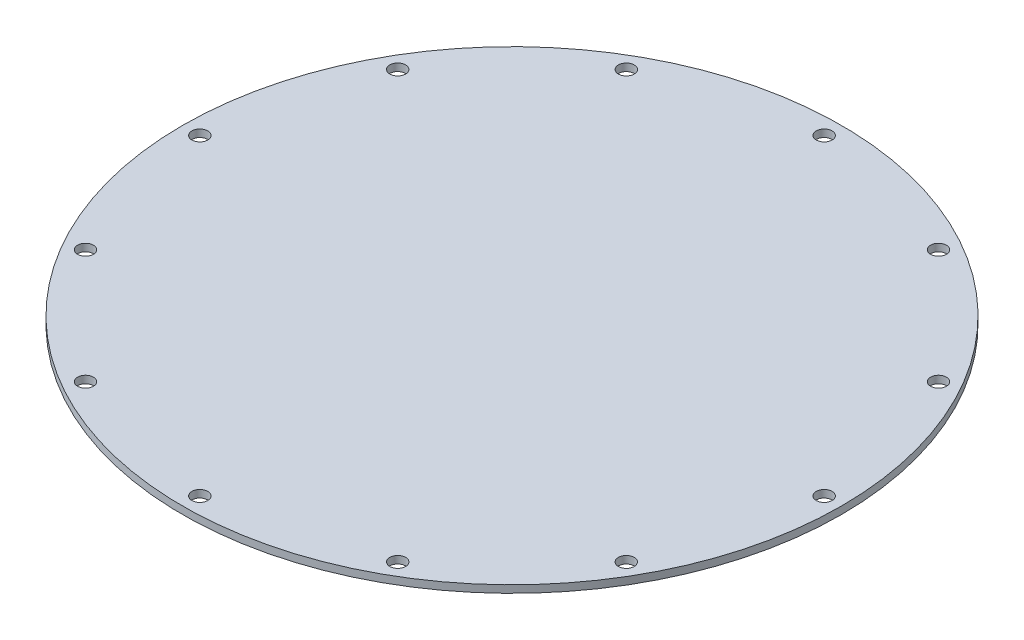
from build123d import *

# Parameters (mm, degrees)
SKETCH1_W          = 66.5
SKETCH1_H          = 1.5
SKETCH7_R          = 1.6
CUT_EXTRUDE1_DEPTH = 95.05716347
CIRPATTERN2_COUNT  = 12


with BuildPart() as part:
    # Sketch1 → Revolve1 (revolve)
    with BuildSketch(Plane.XY):
        with Locations((-33.25, 19.715)):
            Rectangle(SKETCH1_W, SKETCH1_H)
    revolve(axis=Axis((0, 20.465, 0), (0, -1, 0)))

    # Sketch7 → Cut-Extrude1 (cut, through all)
    with BuildSketch(Plane(origin=(0, 20.465, 0), x_dir=(1, 0, 0), z_dir=(0, 1, 0))):
        with Locations(Location((0, 63, 0), (0, 0, 180))):
            Circle(SKETCH7_R)
    cut_extrude1 = extrude(amount=-CUT_EXTRUDE1_DEPTH, mode=Mode.SUBTRACT)

    # CirPattern2: Cut-Extrude1 ×12 about axis
    cirpattern2_axis = Axis((0, 0, 0), (0, 1, 0))
    for i in range(1, CIRPATTERN2_COUNT):
        add(cut_extrude1.rotate(cirpattern2_axis, i * 360 / CIRPATTERN2_COUNT), mode=Mode.SUBTRACT)


solid = part.part
